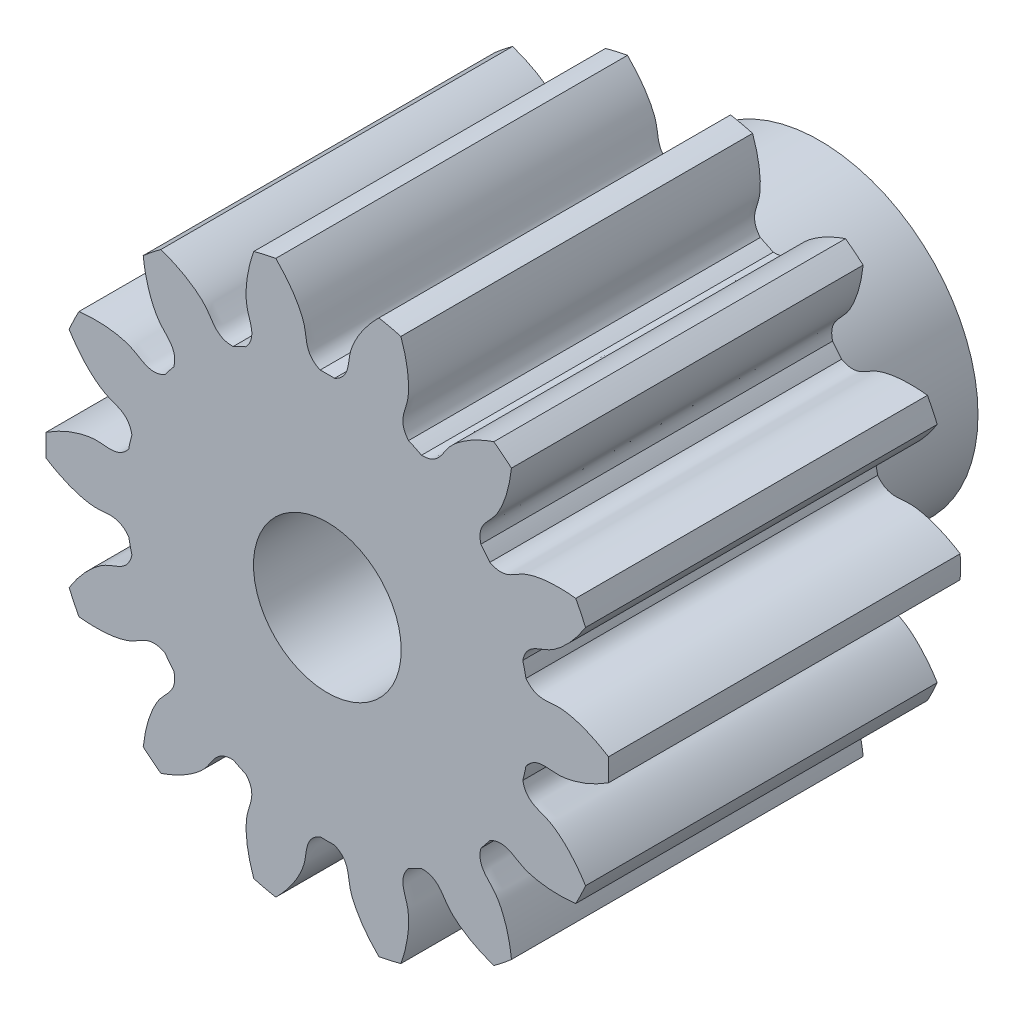
from build123d import *

# Parameters (mm, degrees)
SKETCH_1_R               = 4
EXTRUDE_1_DEPTH          = 5
CUT_EXTRUDE_1_DEPTH      = 8.549834435
PATTERN_CIRCULAR_1_COUNT = 14
SKETCH_4_R               = 2.25
SKETCH_4_R_2             = 1.05
EXTRUDE_2_DEPTH          = 2
CUT_EXTRUDE_2_REACH      = 9.514
SKETCH_5_R               = 1.05


with BuildPart() as part:
    # 草图1 → 凸台-拉伸1 (new body)
    with BuildSketch(Plane.XY):
        Circle(SKETCH_1_R)
    extrude(amount=EXTRUDE_1_DEPTH)

    # 草图2 → 切除-拉伸1 (cut, through all)
    with BuildSketch(Plane.XY):
        with BuildLine():
            ThreePointArc((0.10215715, 2.873184456), (0, 2.875), (-0.10215715, 2.873184456))
            add(Edge.make_bspline(
                [(-0.10215715, 2.873184456), (-0.323330347, 2.974011361), (-0.285874486, 3.15854782), (-0.331834469, 3.325704537), (-0.335384433, 3.337688234), (-0.339572539, 3.350852272), (-0.344446031, 3.365175672), (-0.350053163, 3.380635708), (-0.356441053, 3.397208295), (-0.363656288, 3.414867892), (-0.37174469, 3.433587549), (-0.38075134, 3.453338924), (-0.39072052, 3.474092297), (-0.401695681, 3.495816595), (-0.413719409, 3.518479414), (-0.426833384, 3.542047037), (-0.441078351, 3.566484464), (-0.456494079, 3.591755429), (-0.473119332, 3.61782243), (-0.490991832, 3.644646755), (-0.510148228, 3.672188504), (-0.530624064, 3.700406623), (-0.552453746, 3.729258928), (-0.575670511, 3.758702136), (-0.600306402, 3.788691895), (-0.62639223, 3.819182813), (-0.653957553, 3.850128493), (-0.683030643, 3.881481562), (-0.713638464, 3.913193704), (-0.74580664, 3.945215698), (-0.779559436, 3.977497445), (-0.814919726, 4.009988011), (-0.851908976, 4.042635655), (-0.890547219, 4.075387872), (-0.930853029, 4.108191423), (-0.972843509, 4.14099238), (-1.01653426, 4.173736157), (-1.061939371, 4.206367551), (-1.109071394, 4.238830784), (-1.157941332, 4.271069536), (-1.208558619, 4.303026991), (-1.260931107, 4.334645873), (-1.315065048, 4.365868491), (-1.370965088, 4.396636773), (-1.428634239, 4.426892317), (-1.50867182, 4.466862993), (-1.570186947, 4.495289718), (-1.611953727, 4.513605383)],
                knots=[0, 0, 0, 0, 0.215624359, 0.220482059, 0.225911253, 0.231911941, 0.238484123, 0.245627799, 0.253342969, 0.261629634, 0.270487792, 0.279917445, 0.289918591, 0.300491232, 0.311635367, 0.323350996, 0.335638119, 0.348496736, 0.361926847, 0.375928452, 0.390501552, 0.405646145, 0.421362233, 0.437649814, 0.45450889, 0.47193946, 0.489941524, 0.508515082, 0.527660134, 0.54737668, 0.56766472, 0.588524254, 0.609955283, 0.631957805, 0.654531822, 0.677677333, 0.701394337, 0.725682836, 0.750542829, 0.775974316, 0.801977297, 0.828551773, 0.855697742, 0.883415205, 0.911704163, 0.940564615, 1, 1, 1, 1], degree=3))
            ThreePointArc((-1.611953727, 4.513605383), (0, 4.792810071), (1.611953727, 4.513605383))
            add(Edge.make_bspline(
                [(0.10215715, 2.873184456), (0.323330347, 2.974011361), (0.285874486, 3.15854782), (0.331834469, 3.325704537), (0.335384433, 3.337688234), (0.339572539, 3.350852272), (0.344446031, 3.365175672), (0.350053163, 3.380635708), (0.356441053, 3.397208295), (0.363656288, 3.414867892), (0.37174469, 3.433587549), (0.38075134, 3.453338924), (0.39072052, 3.474092297), (0.401695681, 3.495816595), (0.413719409, 3.518479414), (0.426833384, 3.542047037), (0.441078351, 3.566484464), (0.456494079, 3.591755429), (0.473119332, 3.61782243), (0.490991832, 3.644646755), (0.510148228, 3.672188504), (0.530624064, 3.700406623), (0.552453746, 3.729258928), (0.575670511, 3.758702136), (0.600306402, 3.788691895), (0.62639223, 3.819182813), (0.653957553, 3.850128493), (0.683030643, 3.881481562), (0.713638464, 3.913193704), (0.74580664, 3.945215698), (0.779559436, 3.977497445), (0.814919726, 4.009988011), (0.851908976, 4.042635655), (0.890547219, 4.075387872), (0.930853029, 4.108191423), (0.972843509, 4.14099238), (1.01653426, 4.173736157), (1.061939371, 4.206367551), (1.109071394, 4.238830784), (1.157941332, 4.271069536), (1.208558619, 4.303026991), (1.260931107, 4.334645873), (1.315065048, 4.365868491), (1.370965088, 4.396636773), (1.428634239, 4.426892317), (1.50867182, 4.466862993), (1.570186947, 4.495289718), (1.611953727, 4.513605383)],
                knots=[0, 0, 0, 0, 0.215624359, 0.220482059, 0.225911253, 0.231911941, 0.238484123, 0.245627799, 0.253342969, 0.261629634, 0.270487792, 0.279917445, 0.289918591, 0.300491232, 0.311635367, 0.323350996, 0.335638119, 0.348496736, 0.361926847, 0.375928452, 0.390501552, 0.405646145, 0.421362233, 0.437649814, 0.45450889, 0.47193946, 0.489941524, 0.508515082, 0.527660134, 0.54737668, 0.56766472, 0.588524254, 0.609955283, 0.631957805, 0.654531822, 0.677677333, 0.701394337, 0.725682836, 0.750542829, 0.775974316, 0.801977297, 0.828551773, 0.855697742, 0.883415205, 0.911704163, 0.940564615, 1, 1, 1, 1], degree=3))
        make_face()
    cut_extrude_1 = extrude(amount=CUT_EXTRUDE_1_DEPTH, mode=Mode.SUBTRACT)

    # 阵列(圆周)1: 切除-拉伸1 ×14 about axis
    pattern_circular_1_axis = Axis((0, 0, 5), (0, 0, -1))
    for i in range(1, PATTERN_CIRCULAR_1_COUNT):
        add(cut_extrude_1.rotate(pattern_circular_1_axis, i * 360 / PATTERN_CIRCULAR_1_COUNT), mode=Mode.SUBTRACT)

    # 草图4 → 凸台-拉伸2 (add)
    with BuildSketch(Plane(origin=(0, 0, 0), x_dir=(-1, 0, 0), z_dir=(0, 0, -1))):
        Circle(SKETCH_4_R)
        Circle(SKETCH_4_R_2, mode=Mode.SUBTRACT)
    extrude(amount=EXTRUDE_2_DEPTH)

    # 草图5 → 切除-拉伸2 (cut, up to next)
    with BuildSketch(Plane(origin=(0, 0, 0), x_dir=(-1, 0, 0), z_dir=(0, 0, -1)), mode=Mode.PRIVATE) as cut_extrude_2_sk1:
        Circle(SKETCH_5_R)
    cut_extrude_2_tool1 = extrude(cut_extrude_2_sk1.sketch, amount=-CUT_EXTRUDE_2_REACH, mode=Mode.PRIVATE) & part.part
    add(cut_extrude_2_tool1.solids().sort_by_distance((0, 0, 0))[0], mode=Mode.SUBTRACT)


solid = part.part
